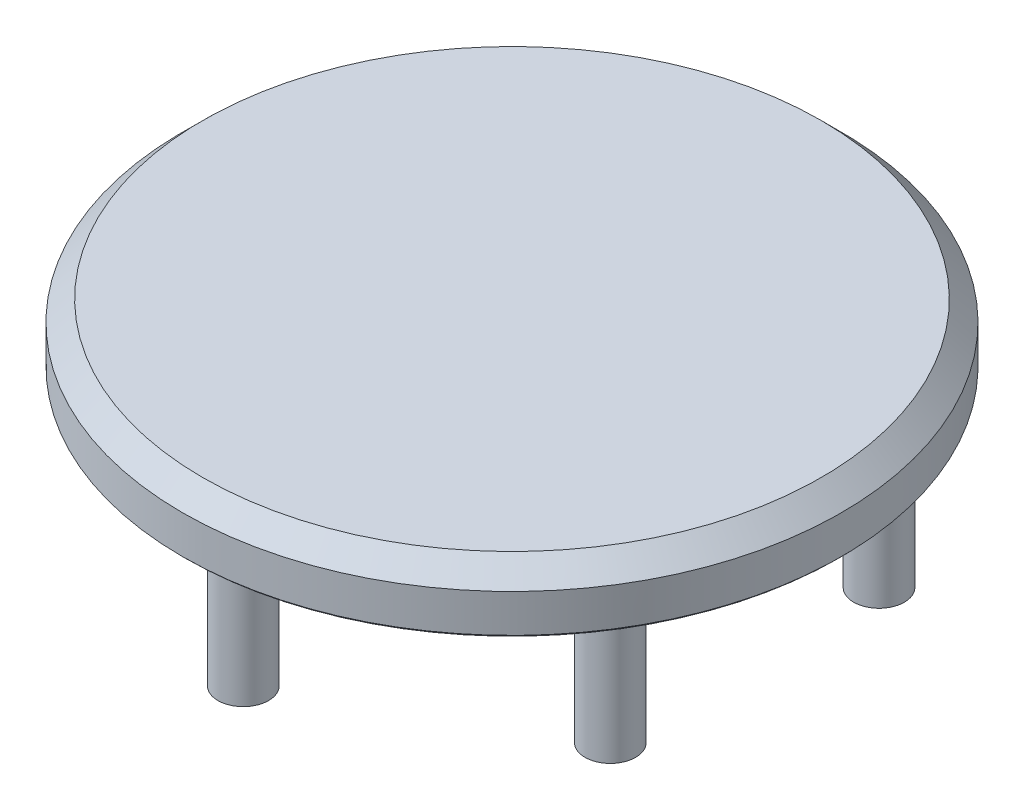
from build123d import *

# Parameters (mm, degrees)
SKETCH3_W           = 32.5
SKETCH3_H           = 6
CHAMFER2_SIZE       = 2
SKETCH4_R           = 2.5
BOSS_EXTRUDE1_DEPTH = 13.8
CIRPATTERN1_COUNT   = 6
CHAMFER3_SIZE       = 2
CHAMFER4_SIZE       = 0.25


with BuildPart() as part:
    # Sketch3 → Revolve1 (revolve)
    with BuildSketch(Plane(origin=(0, 0, 0), x_dir=(0, 0, -1), z_dir=(1, 0, 0))):
        with Locations((-16.25, 28)):
            Rectangle(SKETCH3_W, SKETCH3_H)
    revolve(axis=Axis((0, 0, 0), (0, -1, 0)))

    # Chamfer2
    chamfer2_edges = [part.edges().sort_by_distance(p)[0] for p in [
        (0, 31, -32.5),
    ]]
    chamfer(chamfer2_edges, length=CHAMFER2_SIZE)

    # Sketch4 → Boss-Extrude1 (add)
    with BuildSketch(Plane.XZ.offset(-25)):
        with Locations(Location((0, 26.5, 0), (0, 0, 90))):
            Circle(SKETCH4_R)
    boss_extrude1 = extrude(amount=BOSS_EXTRUDE1_DEPTH)

    # CirPattern1: Boss-Extrude1 ×6 about axis
    cirpattern1_axis = Axis((0, 0, 0), (0, 1, 0))
    for i in range(1, CIRPATTERN1_COUNT):
        add(boss_extrude1.rotate(cirpattern1_axis, i * 360 / CIRPATTERN1_COUNT))

    # Chamfer3
    chamfer3_edges = [part.edges().sort_by_distance(p)[0] for p in [
        (0, 25, 24),
        (20.784609691, 25, 12),
        (20.784609691, 25, -12),
        (0, 25, -24),
        (-20.784609691, 25, -12),
        (-20.784609691, 25, 12),
    ]]
    chamfer(chamfer3_edges, length=CHAMFER3_SIZE)

    # Chamfer4
    chamfer4_edges = [part.edges().sort_by_distance(p)[0] for p in [
        (0, 25, -32.5),
    ]]
    chamfer(chamfer4_edges, length=CHAMFER4_SIZE)


solid = part.part
